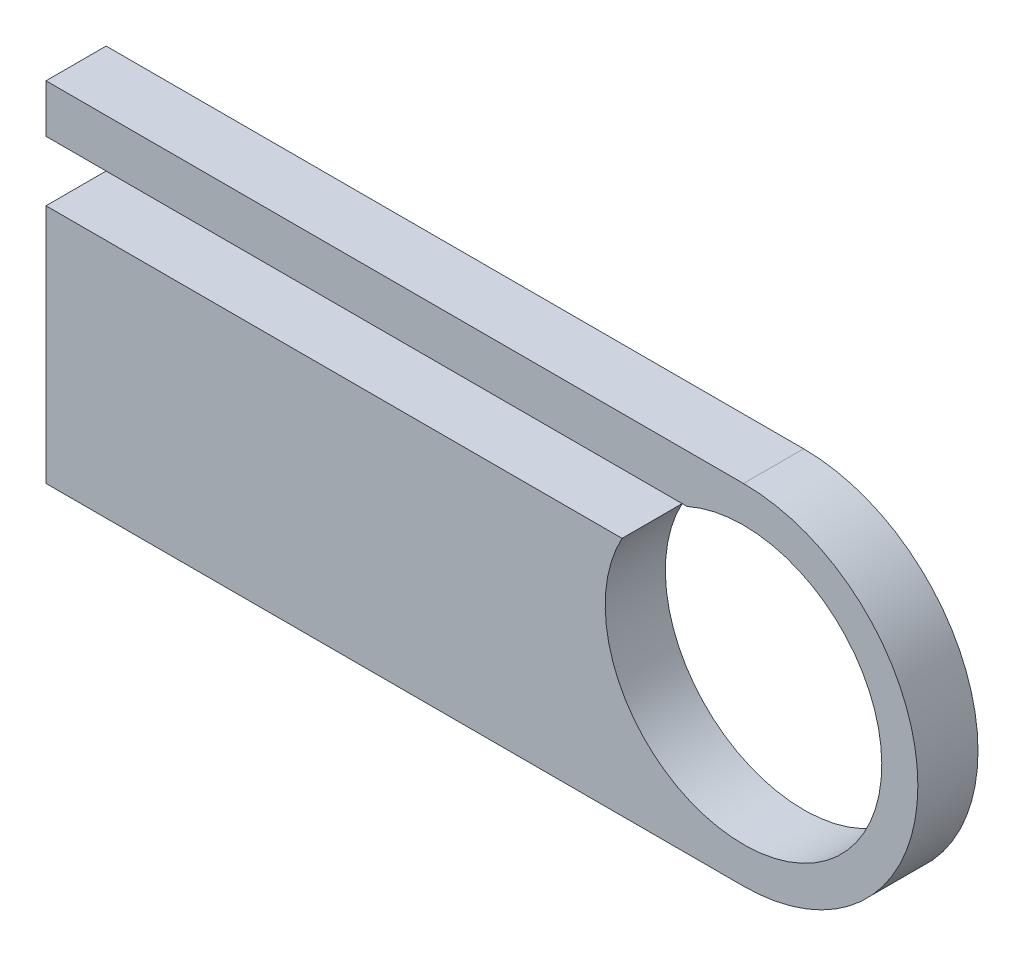
from build123d import *

# Parameters (mm, degrees)
BOSS_EXTRUDE1_DEPTH = 5


with BuildPart() as part:
    # Sketch1 → Boss-Extrude1 (new body)
    with BuildSketch(Plane.XY):
        with BuildLine():
            Line((0, 0), (0, 4))
            Line((0, 4), (58, 4))
            ThreePointArc((58, 4), (72.5, -10.5), (58, -25))
            Line((58, -25), (0, -25))
            Line((0, -25), (0, -5))
            Line((0, -5), (47.900495062, -5))
            ThreePointArc((47.900495062, -5), (65.806115459, -18.944794932), (53.30958424, 0))
            Line((53.30958424, 0), (0, 0))
        make_face()
    extrude(amount=BOSS_EXTRUDE1_DEPTH)


solid = part.part
